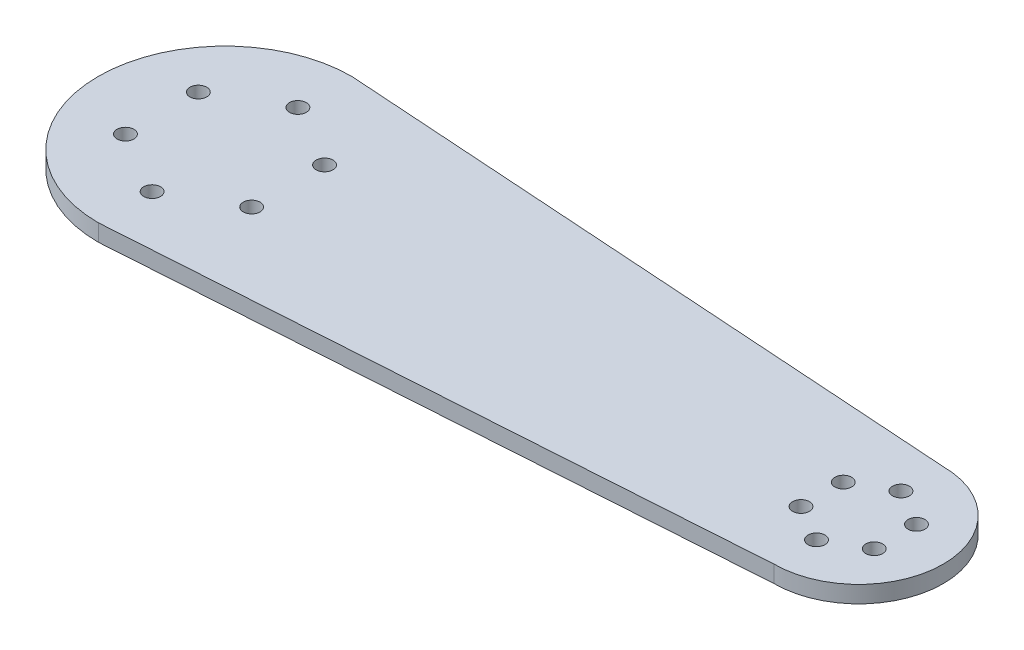
from build123d import *

# Parameters (mm, degrees)
SKETCH_1_R      = 2
EXTRUDE_2_DEPTH = 4


with BuildPart() as part:
    # 草图1 → 凸台-拉伸2 (new body)
    with BuildSketch(Plane(origin=(0, 0, 0), x_dir=(1, 0, 0), z_dir=(0, 1, 0))):
        with BuildLine():
            Line((0, -30), (150, -20))
            ThreePointArc((150, -20), (170, 0), (150, 20))
            Line((150, 20), (0, 30))
            ThreePointArc((0, 30), (-30, 0), (0, -30))
        make_face()
        with Locations(Location((0, -17.25, 0), (0, 0, 270))):
            Circle(SKETCH_1_R, mode=Mode.SUBTRACT)
        with Locations(Location((-14.938938215, -8.625, 0), (0, 0, 270))):
            Circle(SKETCH_1_R, mode=Mode.SUBTRACT)
        with Locations(Location((14.938938215, -8.625, 0), (0, 0, 270))):
            Circle(SKETCH_1_R, mode=Mode.SUBTRACT)
        with Locations(Location((-14.938938215, 8.625, 0), (0, 0, 270))):
            Circle(SKETCH_1_R, mode=Mode.SUBTRACT)
        with Locations(Location((14.938938215, 8.625, 0), (0, 0, 270))):
            Circle(SKETCH_1_R, mode=Mode.SUBTRACT)
        with Locations(Location((0, 17.25, 0), (0, 0, 270))):
            Circle(SKETCH_1_R, mode=Mode.SUBTRACT)
        with Locations(Location((141.339745962, -5, 0), (0, 0, 270))):
            Circle(SKETCH_1_R, mode=Mode.SUBTRACT)
        with Locations(Location((150, -10, 0), (0, 0, 270))):
            Circle(SKETCH_1_R, mode=Mode.SUBTRACT)
        with Locations(Location((158.660254038, -5, 0), (0, 0, 270))):
            Circle(SKETCH_1_R, mode=Mode.SUBTRACT)
        with Locations(Location((158.660254038, 5, 0), (0, 0, 270))):
            Circle(SKETCH_1_R, mode=Mode.SUBTRACT)
        with Locations(Location((150, 10, 0), (0, 0, 270))):
            Circle(SKETCH_1_R, mode=Mode.SUBTRACT)
        with Locations(Location((141.339745962, 5, 0), (0, 0, 270))):
            Circle(SKETCH_1_R, mode=Mode.SUBTRACT)
    extrude(amount=EXTRUDE_2_DEPTH)


solid = part.part
